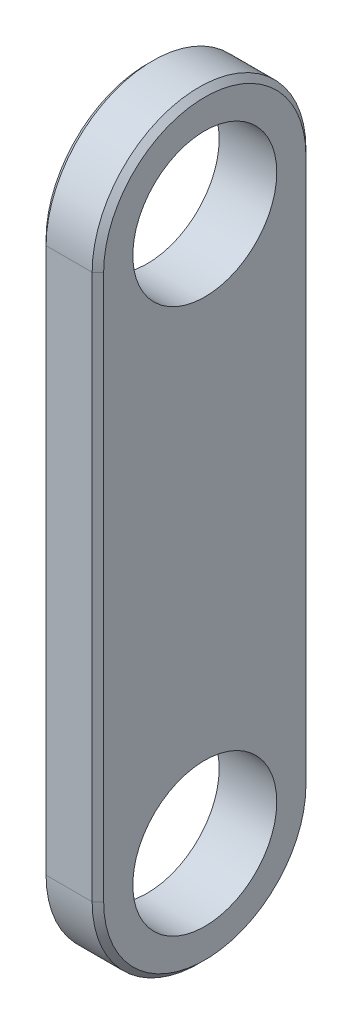
from build123d import *

# Parameters (mm, degrees)
SKETCH1_R           = 25
BOSS_EXTRUDE1_DEPTH = 10
CHAMFER1_SIZE       = 2


with BuildPart() as part:
    # Sketch1 → Boss-Extrude1 (new, symmetric)
    with BuildSketch(Plane.YZ):
        with BuildLine():
            Line((94.677868983, -37.128576072), (-94.677868983, -37.128576072))
            ThreePointArc((-94.677868983, -37.128576072), (-131.806445055, 0), (-94.677868983, 37.128576072))
            Line((-94.677868983, 37.128576072), (94.677868983, 37.128576072))
            ThreePointArc((94.677868983, 37.128576072), (131.806445055, 0), (94.677868983, -37.128576072))
        make_face()
        with Locations(Location((-94.677868983, 0, 0), (0, 0, 270))):
            Circle(SKETCH1_R, mode=Mode.SUBTRACT)
        with Locations(Location((94.677868983, 0, 0), (0, 0, 270))):
            Circle(SKETCH1_R, mode=Mode.SUBTRACT)
    extrude(amount=BOSS_EXTRUDE1_DEPTH, both=True)

    # Chamfer1
    chamfer1_edges = [part.edges().sort_by_distance(p)[0] for p in [
        (10, -131.806445055, 0),
        (10, 0, -37.128576072),
        (10, 131.806445055, 0),
        (-10, 0, -37.128576072),
        (-10, -131.806445055, 0),
        (-10, 0, 37.128576072),
        (-10, 131.806445055, 0),
        (10, 0, 37.128576072),
    ]]
    chamfer(chamfer1_edges, length=CHAMFER1_SIZE)


solid = part.part
